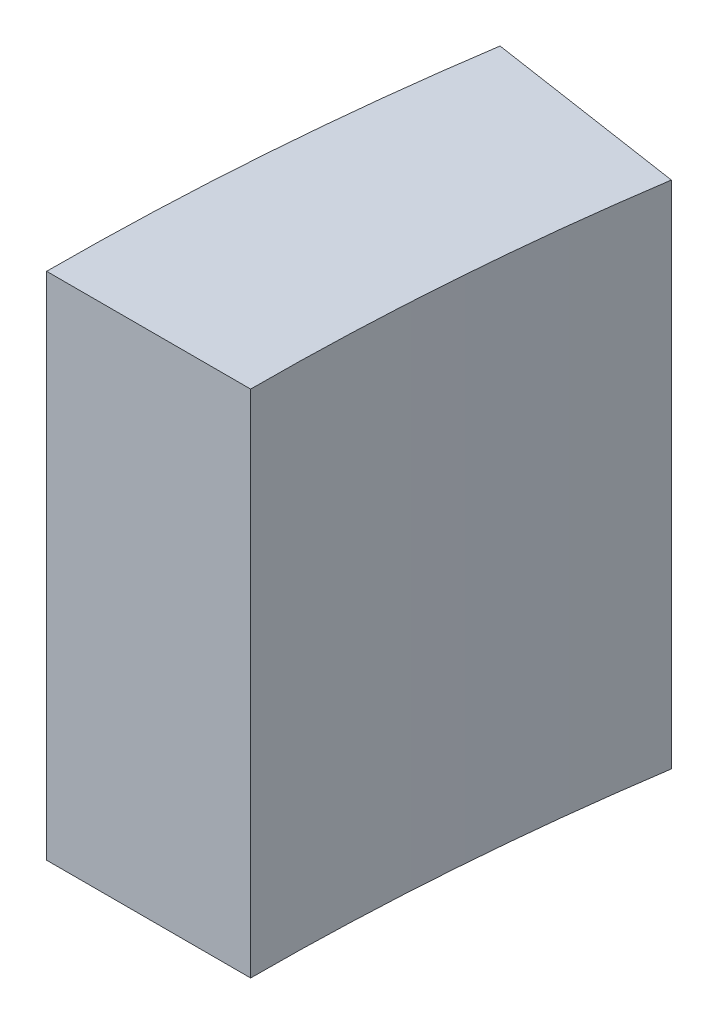
from build123d import *

# Parameters (mm, degrees)
SKETCH1_R           = 55.5
SKETCH1_R_2         = 51.5
BOSS_EXTRUDE1_DEPTH = 10
CUT_EXTRUDE1_DEPTH  = 80.123321467


with BuildPart() as part:
    # Sketch1 → Boss-Extrude1 (new body)
    with BuildSketch(Plane(origin=(0, 0, 0), x_dir=(1, 0, 0), z_dir=(0, 1, 0))):
        with Locations(Location((0, 0, 0), (0, 0, 270))):
            Circle(SKETCH1_R)
        with Locations(Location((0, 0, 0), (0, 0, 270))):
            Circle(SKETCH1_R_2, mode=Mode.SUBTRACT)
    extrude(amount=BOSS_EXTRUDE1_DEPTH)

    # Sketch2 → Cut-Extrude1 (cut, through all)
    with BuildSketch(Plane(origin=(0, 10, 0), x_dir=(1, 0, 0), z_dir=(0, 1, 0))):
        with BuildLine():
            Line((0, 0), (-65.560036271, 0))
            ThreePointArc((-65.560036271, 0), (65.376778185, -4.898492618), (-64.828028441, 9.769600004))
            Line((-64.828028441, 9.769600004), (0, 0))
        make_face()
    extrude(amount=-CUT_EXTRUDE1_DEPTH, mode=Mode.SUBTRACT)


solid = part.part
